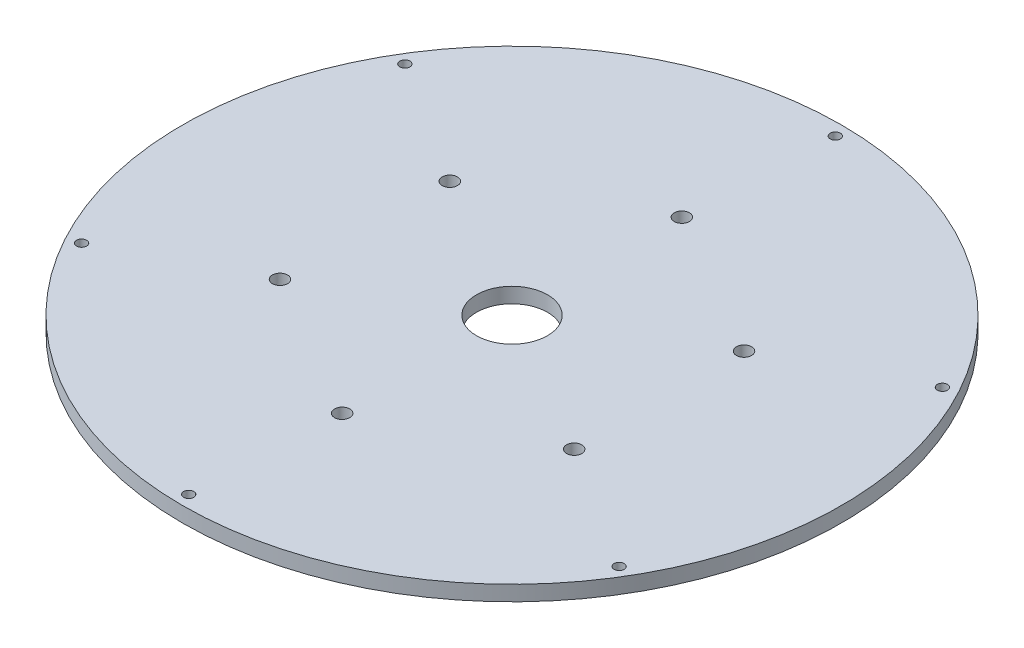
from build123d import *

# Parameters (mm, degrees)
ESQUISSE1_R             = 65
BOSS_EXTRU_1_DEPTH      = 3
ESQUISSE2_R             = 1
ENL_V_MAT_EXTRU_1_DEPTH = 3
ESQUISSE3_R             = 7
ENL_V_MAT_EXTRU_2_DEPTH = 3
ESQUISSE4_R             = 1.5
ENL_V_MAT_EXTRU_4_DEPTH = 4


with BuildPart() as part:
    # Esquisse1 → Boss.-Extru.1 (new body)
    with BuildSketch(Plane(origin=(0, 0, 0), x_dir=(1, 0, 0), z_dir=(0, 1, 0))):
        with Locations(Location((0, 0, 0), (0, 0, 270))):
            Circle(ESQUISSE1_R)
    extrude(amount=BOSS_EXTRU_1_DEPTH)

    # Esquisse2 → Enlèv. mat.-Extru.1 (cut)
    with BuildSketch(Plane(origin=(0, 3, 0), x_dir=(1, 0, 0), z_dir=(0, 1, 0))):
        with Locations(Location((-53.47585562, 32.350932996, 0), (0, 0, 270))):
            Circle(ESQUISSE2_R)
        with Locations(Location((-54.754657621, -30.135982958, 0), (0, 0, 270))):
            Circle(ESQUISSE2_R)
        with Locations(Location((-1.278802001, -62.486915954, 0), (0, 0, 270))):
            Circle(ESQUISSE2_R)
        with Locations(Location((53.47585562, -32.350932996, 0), (0, 0, 270))):
            Circle(ESQUISSE2_R)
        with Locations(Location((54.754657621, 30.135982958, 0), (0, 0, 270))):
            Circle(ESQUISSE2_R)
        with Locations(Location((1.278802001, 62.486915954, 0), (0, 0, 270))):
            Circle(ESQUISSE2_R)
    extrude(amount=-ENL_V_MAT_EXTRU_1_DEPTH, mode=Mode.SUBTRACT)

    # Esquisse3 → Enlèv. mat.-Extru.2 (cut)
    with BuildSketch(Plane(origin=(0, 3, 0), x_dir=(1, 0, 0), z_dir=(0, 1, 0))):
        with Locations(Location((0, 0, 0), (0, 0, 270))):
            Circle(ESQUISSE3_R)
    extrude(amount=-ENL_V_MAT_EXTRU_2_DEPTH, mode=Mode.SUBTRACT)

    # Esquisse4 → Enlèv. mat.-Extru.4 (cut)
    with BuildSketch(Plane(origin=(0, 3, 0), x_dir=(1, 0, 0), z_dir=(0, 1, 0))):
        with Locations(Location((0, 33.5, 0), (0, 0, 270))):
            Circle(ESQUISSE4_R)
        with Locations(Location((29.011851027, 16.75, 0), (0, 0, 270))):
            Circle(ESQUISSE4_R)
        with Locations(Location((29.011851027, -16.75, 0), (0, 0, 270))):
            Circle(ESQUISSE4_R)
        with Locations(Location((0, -33.5, 0), (0, 0, 270))):
            Circle(ESQUISSE4_R)
        with Locations(Location((-29.011851027, -16.75, 0), (0, 0, 270))):
            Circle(ESQUISSE4_R)
        with Locations(Location((-29.011851027, 16.75, 0), (0, 0, 270))):
            Circle(ESQUISSE4_R)
    extrude(amount=-ENL_V_MAT_EXTRU_4_DEPTH, mode=Mode.SUBTRACT)


solid = part.part
